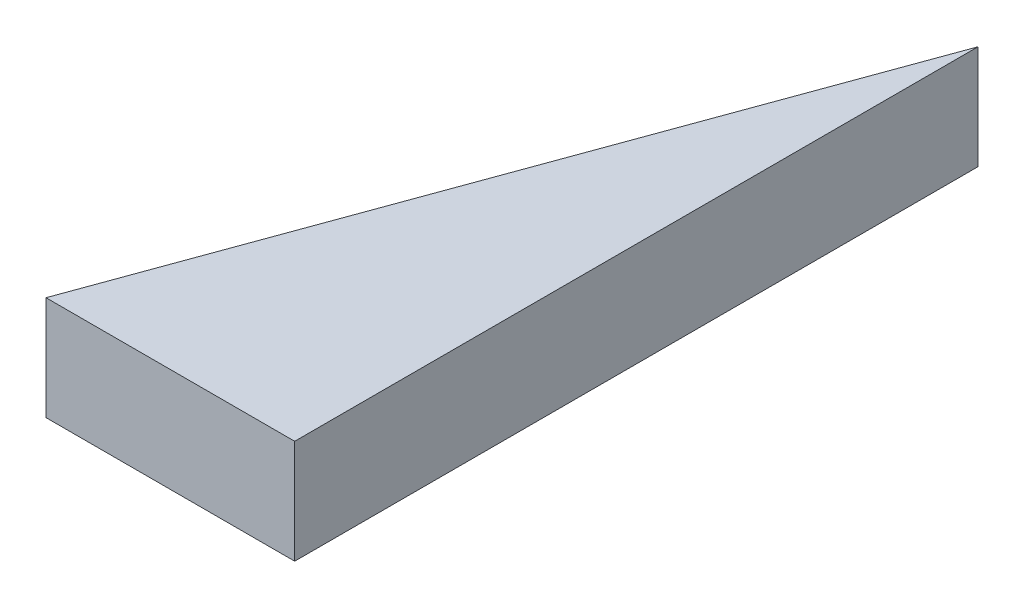
from build123d import *

# Parameters (mm, degrees)
BOSS_EXTRUDE1_DEPTH = 12.7


with BuildPart() as part:
    # Sketch1 → Boss-Extrude1 (new body)
    with BuildSketch(Plane(origin=(0, 0, 0), x_dir=(1, 0, 0), z_dir=(0, 1, 0))):
        Polygon((0, 0), (30.4038, 83.5406), (30.4038, 0), align=None)
    extrude(amount=BOSS_EXTRUDE1_DEPTH)


solid = part.part
